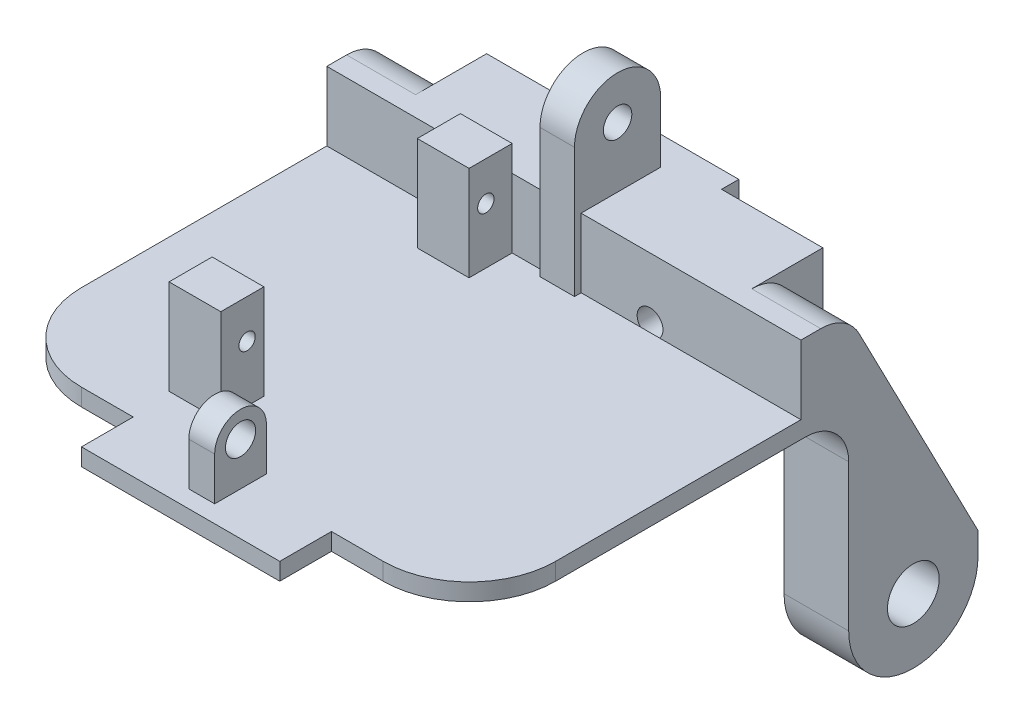
from build123d import *

# Parameters (mm, degrees)
SKETCH_1_W          = 55
SKETCH_1_H          = 39
EXTRUDE_1_DEPTH     = 2
SKETCH_2_W          = 23
SKETCH_2_H          = 6
EXTRUDE_2_DEPTH     = 2
SKETCH_3_W          = 6
SKETCH_3_H          = 5
EXTRUDE_3_DEPTH     = 11
SKETCH_5_R          = 0.95
CUT_EXTRUDE_1_DEPTH = 11
SKETCH_6_W          = 55
SKETCH_6_H          = 0.541458129
EXTRUDE_4_DEPTH     = 8
SKETCH_8_R          = 1.65
EXTRUDE_6_DEPTH     = 2
SKETCH_10_W         = 3
SKETCH_10_H         = 6
EXTRUDE_7_DEPTH     = 8
SKETCH_11_R         = 1.5
CUT_EXTRUDE_3_DEPTH = 13
SKETCH_12_R         = 3
EXTRUDE_8_DEPTH     = 7.5
SKETCH_13_W         = 10
SKETCH_13_H         = 3.7
EXTRUDE_9_DEPTH     = 1
FILLET_3_RADIUS     = 3
FILLET_3_LENGTH     = 3
SKETCH_15_R         = 1.75
CUT_EXTRUDE_5_DEPTH = 23
SKETCH_16_W         = 15.5
SKETCH_16_H         = 4
EXTRUDE_10_DEPTH    = 20
SKETCH_17_R         = 1.5
EXTRUDE_11_DEPTH    = 10
FILLET_4_R          = 10
SKETCH_18_W         = 26.564734734
SKETCH_18_H         = 10.454508508
CUT_EXTRUDE_6_DEPTH = 10
CUT_EXTRUDE_7_DEPTH = 8
CUT_EXTRUDE_8_DEPTH = 8
FILLET_6_R          = 5
FILLET_7_R          = 10
SKETCH_21_R         = 1.4
CUT_EXTRUDE_9_DEPTH = 4


with BuildPart() as part:
    # 草图1 → 凸台-拉伸1 (new body)
    with BuildSketch(Plane(origin=(0, 0, 0), x_dir=(1, 0, 0), z_dir=(0, 1, 0))):
        Rectangle(SKETCH_1_W, SKETCH_1_H)
    extrude(amount=EXTRUDE_1_DEPTH)

    # 草图2 → 凸台-拉伸2 (add)
    with BuildSketch(Plane(origin=(0, 2, 0), x_dir=(1, 0, 0), z_dir=(0, 1, 0))):
        with Locations((0, -22.5)):
            Rectangle(SKETCH_2_W, SKETCH_2_H)
    extrude(amount=-EXTRUDE_2_DEPTH)

    # 草图3 → 凸台-拉伸3 (add)
    with BuildSketch(Plane(origin=(0, 2, 0), x_dir=(1, 0, 0), z_dir=(0, 1, 0))):
        with Locations((-9, -12.341458129)):
            Rectangle(SKETCH_3_W, SKETCH_3_H)
        with Locations((-9, 16.458541871)):
            Rectangle(SKETCH_3_W, SKETCH_3_H)
    extrude(amount=EXTRUDE_3_DEPTH)

    # 草图5 → 切除-拉伸1 (cut)
    with BuildSketch(Plane.ZY.offset(12)):
        with Locations((-15.908541871, 8.5)):
            Circle(SKETCH_5_R)
        with Locations((11.791458129, 8.5)):
            Circle(SKETCH_5_R)
    extrude(amount=-CUT_EXTRUDE_1_DEPTH, mode=Mode.SUBTRACT)

    # 草图6 → 凸台-拉伸4 (add)
    with BuildSketch(Plane(origin=(0, 2, 0), x_dir=(1, 0, 0), z_dir=(0, 1, 0))):
        with Locations((0, 19.229270936)):
            Rectangle(SKETCH_6_W, SKETCH_6_H)
    extrude(amount=EXTRUDE_4_DEPTH)

    # 草图8 → 凸台-拉伸6 (add, symmetric)
    with BuildSketch(Plane(origin=(0, 0, 0), x_dir=(0, 0, -1), z_dir=(1, 0, 0))):
        with BuildLine():
            Line((28.189872998, 17), (28.189872998, 0))
            Line((28.189872998, 0), (18.189872998, 0))
            Line((18.189872998, 0), (18.189872998, 17))
            ThreePointArc((18.189872998, 17), (23.189872998, 22), (28.189872998, 17))
        make_face()
        with Locations((23.189872998, 17)):
            Circle(SKETCH_8_R, mode=Mode.SUBTRACT)
    extrude(amount=EXTRUDE_6_DEPTH, both=True)

    # 草图10 → 凸台-拉伸7 (add)
    with BuildSketch(Plane(origin=(0, 2, 0), x_dir=(1, 0, 0), z_dir=(0, 1, 0))):
        with Locations((0.45, -20.5)):
            Rectangle(SKETCH_10_W, SKETCH_10_H)
    extrude(amount=EXTRUDE_7_DEPTH)

    # 草图11 → 切除-拉伸3 (cut)
    with BuildSketch(Plane.XY.offset(-18.958541871)):
        with Locations((-10, 3)):
            Circle(SKETCH_11_R)
    cut_extrude_3 = extrude(amount=-CUT_EXTRUDE_3_DEPTH, mode=Mode.SUBTRACT)

    # 草图12 → 凸台-拉伸8 (add)
    with BuildSketch(Plane.ZY.offset(27.5)):
        with BuildLine():
            Line((-39.5, -22), (-39.5, 10))
            Line((-39.5, 10), (-19.5, 10))
            Line((-19.5, 10), (-19.5, 0))
            Line((-19.5, 0), (-24.5, 0))
            Line((-24.5, 0), (-24.5, -22))
            ThreePointArc((-24.5, -22), (-32, -29.5), (-39.5, -22))
        make_face()
        with Locations((-32, -22)):
            Circle(SKETCH_12_R, mode=Mode.SUBTRACT)
    extrude_8 = extrude(amount=-EXTRUDE_8_DEPTH)

    # 草图13 → 凸台-拉伸9 (add)
    with BuildSketch(Plane.XZ):
        with Locations((0, 18.15)):
            Rectangle(SKETCH_13_W, SKETCH_13_H)
    extrude(amount=EXTRUDE_9_DEPTH)

    # 镜向1: 切除-拉伸3, 凸台-拉伸8 across plane
    add(cut_extrude_3.mirror(Plane(origin=(0, 0, 0), x_dir=(0, 0, 1), z_dir=(1, 0, 0))), mode=Mode.SUBTRACT)
    add(extrude_8.mirror(Plane(origin=(0, 0, 0), x_dir=(0, 0, 1), z_dir=(1, 0, 0))))

    # 圆角3: full round fillet: the end face becomes a half cylinder, R = half its width
    fillet_3_face = Plane((0.45, 10, 20.5), x_dir=(1, 0, 0), z_dir=(0, 1, 0))  # on the end face: x along it, z out of the body
    fillet_3_slab = fillet_3_face.offset(-FILLET_3_RADIUS / 2) * Box(FILLET_3_LENGTH, 2 * FILLET_3_RADIUS, FILLET_3_RADIUS, mode=Mode.PRIVATE)  # the body's end, R deep
    fillet_3_round = Plane((0.45, 7, 20.5), x_dir=(0, 1, 0), z_dir=(1, 0, 0)) * Cylinder(FILLET_3_RADIUS, FILLET_3_LENGTH, mode=Mode.PRIVATE)  # its axis R under the face
    add(fillet_3_slab - fillet_3_round, mode=Mode.SUBTRACT)

    # 草图15 → 切除-拉伸5 (cut)
    with BuildSketch(Plane.ZY.offset(1.05)):
        with Locations((20.5, 7)):
            Circle(SKETCH_15_R)
    extrude(amount=-CUT_EXTRUDE_5_DEPTH, mode=Mode.SUBTRACT)

    # 草图16 → 凸台-拉伸10 (add)
    with BuildSketch(Plane(origin=(0, 0, -19.5), x_dir=(-1, 0, 0), z_dir=(0, 0, -1))):
        with Locations((0, 8)):
            Rectangle(SKETCH_16_W, SKETCH_16_H)
    extrude(amount=EXTRUDE_10_DEPTH)

    # 草图17 → 凸台-拉伸11 (add)
    # profile 1 of 2: a face of its own
    with BuildSketch(Plane(origin=(0, 0, -19.5), x_dir=(-1, 0, 0), z_dir=(0, 0, -1))):
        Polygon((-20, 0), (-2, 0), (-2, 6), (-7.75, 6), (-7.75, 10), (-20, 10), align=None)
        with Locations(Location((-10, 3, 0), (0, 0, 221.810314896))):
            Circle(SKETCH_17_R, mode=Mode.SUBTRACT)
    # profile 2 of 2: a face of its own
    with BuildSketch(Plane(origin=(0, 0, -19.5), x_dir=(-1, 0, 0), z_dir=(0, 0, -1))):
        Polygon((7.75, 6), (2, 6), (2, 0), (20, 0), (20, 10), (7.75, 10), align=None)
        with Locations(Location((10, 3, 0), (0, 0, 180))):
            Circle(SKETCH_17_R, mode=Mode.SUBTRACT)
    extrude(amount=EXTRUDE_11_DEPTH)

    # 圆角4
    fillet_4_edges = [part.edges().sort_by_distance(p)[0] for p in [
        (23.75, 10, -39.5),
        (-23.75, 10, -39.5),
    ]]
    fillet(fillet_4_edges, radius=FILLET_4_R)

    # 草图18 → 切除-拉伸6 (cut)
    with BuildSketch(Plane(origin=(0, 10, 0), x_dir=(1, 0, 0), z_dir=(0, 1, 0))):
        with Locations((-0.840887807, 36.727254254)):
            Rectangle(SKETCH_18_W, SKETCH_18_H)
    extrude(amount=-CUT_EXTRUDE_6_DEPTH, mode=Mode.SUBTRACT)

    # 草图19 → 切除-拉伸7 (cut)
    with BuildSketch(Plane(origin=(27.5, 0, 0), x_dir=(0, 0, -1), z_dir=(1, 0, 0))):
        Polygon((24.3, 10), (39.5, -19.395601839), (39.5, 10), align=None)
    extrude(amount=-CUT_EXTRUDE_7_DEPTH, mode=Mode.SUBTRACT)

    # 草图20 → 切除-拉伸8 (cut)
    with BuildSketch(Plane.ZY.offset(27.5)):
        Polygon((-24.3, 10), (-39.5, 10), (-39.5, -19.395601839), align=None)
    extrude(amount=-CUT_EXTRUDE_8_DEPTH, mode=Mode.SUBTRACT)

    # 圆角6
    fillet_6_edges = [part.edges().sort_by_distance(p)[0] for p in [
        (-23.75, 0, -24.5),
        (23.75, 0, -24.5),
        (23.5, 10, -24.3),
        (-23.5, 10, -24.3),
    ]]
    fillet(fillet_6_edges, radius=FILLET_6_R)

    # 圆角7
    fillet_7_edges = [part.edges().sort_by_distance(p)[0] for p in [
        (27.5, 1, 19.5),
        (-27.5, 1, 19.5),
    ]]
    fillet(fillet_7_edges, radius=FILLET_7_R)

    # 草图21 → 切除-拉伸9 (cut)
    with BuildSketch(Plane.XZ.offset(1)):
        with Locations(Location((0, 18.15, 0), (0, 0, 270))):
            Circle(SKETCH_21_R)
    extrude(amount=-CUT_EXTRUDE_9_DEPTH, mode=Mode.SUBTRACT)


solid = part.part
